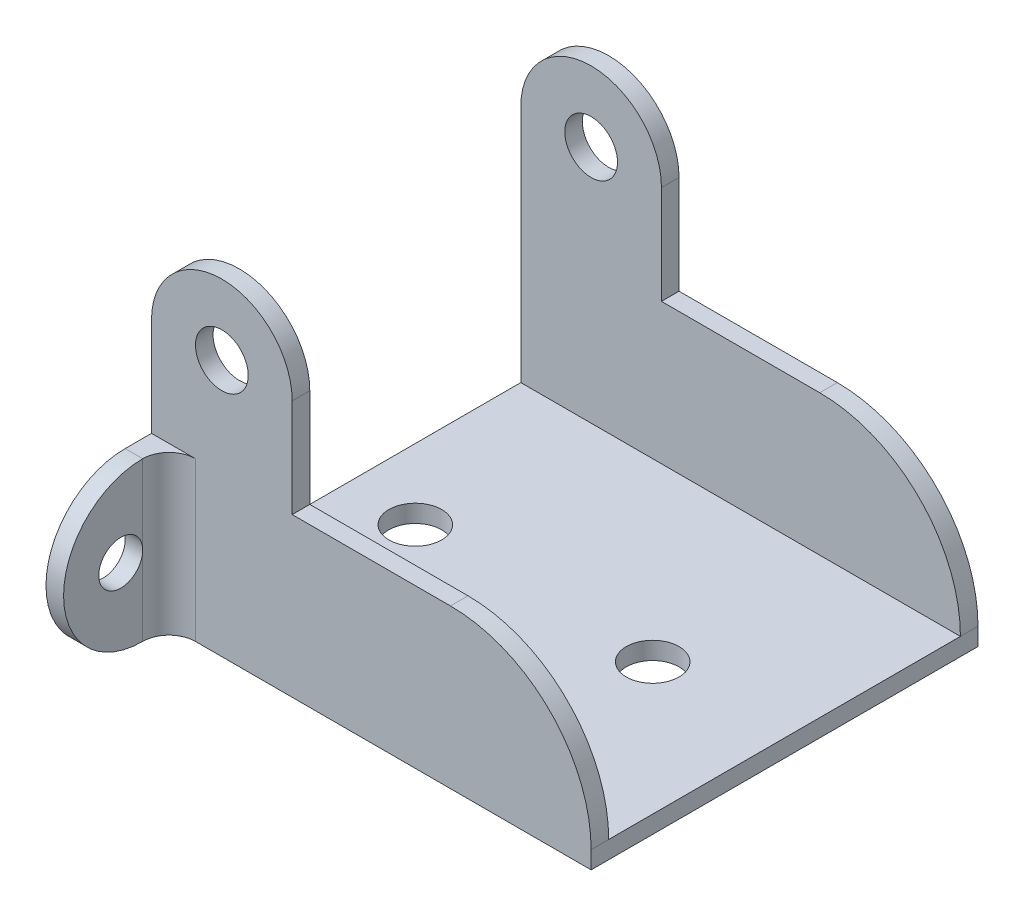
from build123d import *

# Parameters (mm, degrees)
CROQUIS1_W              = 25
CROQUIS1_H              = 22
SALIENTE_EXTRUIR1_DEPTH = 1
CROQUIS2_W              = 8
CROQUIS2_H              = 1
SALIENTE_EXTRUIR2_DEPTH = 17.6
CROQUIS2_3_W            = 17
CROQUIS2_3_H            = 1
SALIENTE_EXTRUIR3_DEPTH = 8
REDONDEO2_RADIUS        = 4
REDONDEO2_LENGTH        = 1
REDONDEO3_R             = 8
REDONDEO4_RADIUS        = 4
REDONDEO4_LENGTH        = 1
CROQUIS4_R              = 1.5
CORTAR_EXTRUIR1_DEPTH   = 32.403980639
CROQUIS5_R              = 1.5
CORTAR_EXTRUIR2_DEPTH   = 25.22828925
CROQUIS6_W              = 1
CROQUIS6_H              = 9
SALIENTE_EXTRUIR4_DEPTH = 6
REDONDEO5_RADIUS        = 4.5
REDONDEO5_LENGTH        = 1
REDONDEO6_R             = 1.5
CORTAR_EXTRUIR3_REACH   = 37.496
CROQUIS7_R              = 1.25
CROQUIS8_W              = 25
CROQUIS8_H              = 11
CORTAR_EXTRUIR4_DEPTH   = 29.128455343


with BuildPart() as part:
    # Croquis1 → Saliente-Extruir1 (new body)
    with BuildSketch(Plane(origin=(0, 0, 0), x_dir=(1, 0, 0), z_dir=(0, 1, 0))):
        Rectangle(CROQUIS1_W, CROQUIS1_H)
    extrude(amount=SALIENTE_EXTRUIR1_DEPTH)

    # Croquis2 → Saliente-Extruir2 (add)
    with BuildSketch(Plane(origin=(0, 1, 0), x_dir=(1, 0, 0), z_dir=(0, 1, 0))):
        with Locations((-8.5, -10.5)):
            Rectangle(CROQUIS2_W, CROQUIS2_H)
        with Locations((-8.5, 10.5)):
            Rectangle(CROQUIS2_W, CROQUIS2_H)
    extrude(amount=SALIENTE_EXTRUIR2_DEPTH)

    # Croquis2<3> → Saliente-Extruir3 (add)
    with BuildSketch(Plane(origin=(0, 1, 0), x_dir=(1, 0, 0), z_dir=(0, 1, 0))):
        with Locations((4, 10.5)):
            Rectangle(CROQUIS2_3_W, CROQUIS2_3_H)
        with Locations((4, -10.5)):
            Rectangle(CROQUIS2_3_W, CROQUIS2_3_H)
    extrude(amount=SALIENTE_EXTRUIR3_DEPTH)

    # Redondeo2: full round fillet: the end face becomes a half cylinder, R = half its width
    redondeo2_face = Plane((-8.5, 18.6, 10.5), x_dir=(0, 0, -1), z_dir=(0, 1, 0))  # on the end face: x along it, z out of the body
    redondeo2_slab = redondeo2_face.offset(-REDONDEO2_RADIUS / 2) * Box(REDONDEO2_LENGTH, 2 * REDONDEO2_RADIUS, REDONDEO2_RADIUS, mode=Mode.PRIVATE)  # the body's end, R deep
    redondeo2_round = Plane((-8.5, 14.6, 10.5), x_dir=(0, 1, 0), z_dir=(0, 0, -1)) * Cylinder(REDONDEO2_RADIUS, REDONDEO2_LENGTH, mode=Mode.PRIVATE)  # its axis R under the face
    add(redondeo2_slab - redondeo2_round, mode=Mode.SUBTRACT)

    # Redondeo3
    redondeo3_edges = [part.edges().sort_by_distance(p)[0] for p in [
        (12.5, 9, 10.5),
        (12.5, 9, -10.5),
    ]]
    fillet(redondeo3_edges, radius=REDONDEO3_R)

    # Redondeo4: full round fillet: the end face becomes a half cylinder, R = half its width
    redondeo4_face = Plane((-8.5, 18.6, -10.5), x_dir=(0, 0, -1), z_dir=(0, 1, 0))  # on the end face: x along it, z out of the body
    redondeo4_slab = redondeo4_face.offset(-REDONDEO4_RADIUS / 2) * Box(REDONDEO4_LENGTH, 2 * REDONDEO4_RADIUS, REDONDEO4_RADIUS, mode=Mode.PRIVATE)  # the body's end, R deep
    redondeo4_round = Plane((-8.5, 14.6, -10.5), x_dir=(0, 1, 0), z_dir=(0, 0, -1)) * Cylinder(REDONDEO4_RADIUS, REDONDEO4_LENGTH, mode=Mode.PRIVATE)  # its axis R under the face
    add(redondeo4_slab - redondeo4_round, mode=Mode.SUBTRACT)

    # Croquis4 → Cortar-Extruir1 (cut, through all)
    with BuildSketch(Plane.XY.offset(11)):
        with Locations((-8.5, 14.6)):
            Circle(CROQUIS4_R)
    extrude(amount=-CORTAR_EXTRUIR1_DEPTH, mode=Mode.SUBTRACT)

    # Croquis5 → Cortar-Extruir2 (cut, through all)
    with BuildSketch(Plane(origin=(0, 1, 0), x_dir=(1, 0, 0), z_dir=(0, 1, 0))):
        with Locations(Location((5, 0, 0), (0, 0, 270))):
            Circle(CROQUIS5_R)
        with Locations(Location((-8.5, 0, 0), (0, 0, 270))):
            Circle(CROQUIS5_R)
    extrude(amount=-CORTAR_EXTRUIR2_DEPTH, mode=Mode.SUBTRACT)

    # Croquis6 → Saliente-Extruir4 (add)
    with BuildSketch(Plane.XY.offset(11)):
        with Locations((-12, 4.5)):
            Rectangle(CROQUIS6_W, CROQUIS6_H)
    extrude(amount=SALIENTE_EXTRUIR4_DEPTH)

    # Redondeo5: full round fillet: the end face becomes a half cylinder, R = half its width
    redondeo5_face = Plane((-12, 4.5, 17), x_dir=(1, 0, 0), z_dir=(0, 0, 1))  # on the end face: x along it, z out of the body
    redondeo5_slab = redondeo5_face.offset(-REDONDEO5_RADIUS / 2) * Box(REDONDEO5_LENGTH, 2 * REDONDEO5_RADIUS, REDONDEO5_RADIUS, mode=Mode.PRIVATE)  # the body's end, R deep
    redondeo5_round = Plane((-12, 4.5, 12.5), x_dir=(0, 0, 1), z_dir=(1, 0, 0)) * Cylinder(REDONDEO5_RADIUS, REDONDEO5_LENGTH, mode=Mode.PRIVATE)  # its axis R under the face
    add(redondeo5_slab - redondeo5_round, mode=Mode.SUBTRACT)

    # Redondeo6
    redondeo6_edges = [part.edges().sort_by_distance(p)[0] for p in [
        (-11.5, 4.5, 11),
    ]]
    fillet(redondeo6_edges, radius=REDONDEO6_R)

    # Croquis7 → Cortar-Extruir3 (cut, up to next)
    with BuildSketch(Plane.ZY.offset(12.5), mode=Mode.PRIVATE) as cortar_extruir3_sk1:
        with Locations((13.75, 4.5)):
            Circle(CROQUIS7_R)
    cortar_extruir3_tool1 = extrude(cortar_extruir3_sk1.sketch, amount=-CORTAR_EXTRUIR3_REACH, mode=Mode.PRIVATE) & part.part
    add(cortar_extruir3_tool1.solids().sort_by_distance((-12.5, 4.5, 13.75))[0], mode=Mode.SUBTRACT)

    # Croquis8 → Cortar-Extruir4 (cut, through all)
    with BuildSketch(Plane.XZ):
        with Locations((0, -5.5)):
            Rectangle(CROQUIS8_W, CROQUIS8_H)
    extrude(amount=-CORTAR_EXTRUIR4_DEPTH, mode=Mode.SUBTRACT)

    # Simetría1: part across plane


with BuildPart() as part_1:
    add(part.part)
    add(part.part.mirror(Plane.XY))


solid = part_1.part
